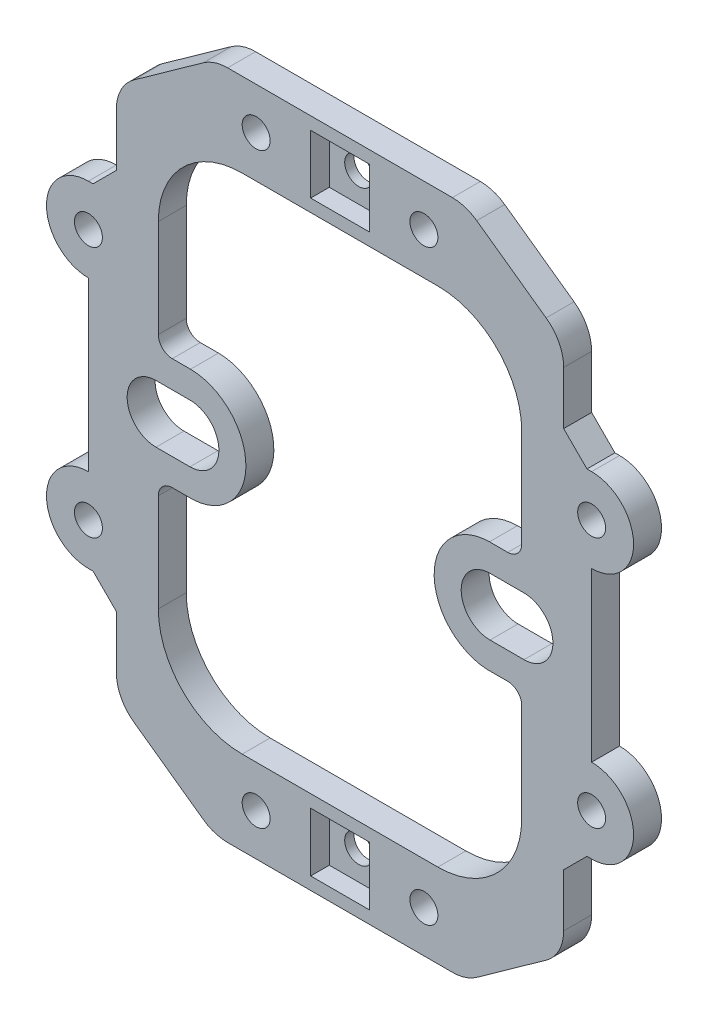
from build123d import *

# Parameters (mm, degrees)
MODEL_R                 = 1.5
SALIENTE_EXTRUIR1_DEPTH = 3
CROQUIS1_W              = 6.3
CROQUIS1_H              = 6.3
CORTAR_EXTRUIR1_DEPTH   = 2


with BuildPart() as part:
    # Model → Saliente-Extruir1 (new body)
    with BuildSketch(Plane.XY):
        with BuildLine():
            Line((64.337531364, 275.445982488), (61.837531364, 277.945982488))
            Line((61.837531364, 277.945982488), (61.837531364, 283.629591549))
            ThreePointArc((61.837531364, 283.629591549), (61.338785756, 285.688708663), (59.953103236, 287.29139217))
            Line((59.953103236, 287.29139217), (52.511010495, 292.607172698))
            ThreePointArc((52.511010495, 292.607172698), (51.268737063, 293.230701866), (49.895438624, 293.445372078))
            Line((49.895438624, 293.445372078), (25.779624104, 293.445372078))
            ThreePointArc((25.779624104, 293.445372078), (24.406325665, 293.230701866), (23.164052233, 292.607172698))
            Line((23.164052233, 292.607172698), (15.721959492, 287.29139217))
            ThreePointArc((15.721959492, 287.29139217), (14.336276972, 285.688708663), (13.837531364, 283.629591549))
            Line((13.837531364, 283.629591549), (13.837531364, 277.945982488))
            Line((13.837531364, 277.945982488), (11.337531364, 275.445982488))
            Line((11.337531364, 275.445982488), (10.837531364, 275.445982488))
            ThreePointArc((10.837531364, 275.445982488), (6.337531364, 270.945982488), (10.837531364, 266.445982488))
            Line((10.837531364, 266.445982488), (10.837531364, 248.445982488))
            ThreePointArc((10.837531364, 248.445982488), (6.337531364, 243.945982488), (10.837531364, 239.445982488))
            Line((10.837531364, 239.445982488), (11.337531364, 239.445982488))
            Line((11.337531364, 239.445982488), (13.837531364, 236.945982488))
            Line((13.837531364, 236.945982488), (13.837531364, 231.261763016))
            ThreePointArc((13.837531364, 231.261763016), (14.336276972, 229.202645903), (15.721959492, 227.599962396))
            Line((15.721959492, 227.599962396), (23.164052233, 222.284181867))
            ThreePointArc((23.164052233, 222.284181867), (24.406325665, 221.660652699), (25.779624104, 221.445982488))
            Line((25.779624104, 221.445982488), (49.895438624, 221.445982488))
            ThreePointArc((49.895438624, 221.445982488), (51.268737063, 221.660652699), (52.511010495, 222.284181867))
            Line((52.511010495, 222.284181867), (59.953103236, 227.599962396))
            ThreePointArc((59.953103236, 227.599962396), (61.338785756, 229.202645903), (61.837531364, 231.261763016))
            Line((61.837531364, 231.261763016), (61.837531364, 236.945982488))
            Line((61.837531364, 236.945982488), (64.337531364, 239.445982488))
            Line((64.337531364, 239.445982488), (64.837531364, 239.445982488))
            ThreePointArc((64.837531364, 239.445982488), (69.337531364, 243.945982488), (64.837531364, 248.445982488))
            Line((64.837531364, 248.445982488), (64.837531364, 266.445982488))
            ThreePointArc((64.837531364, 266.445982488), (69.337531364, 270.945982488), (64.837531364, 275.445982488))
            Line((64.837531364, 275.445982488), (64.337531364, 275.445982488))
        make_face()
        with Locations((28.837531364, 225.945982488)):
            Circle(MODEL_R, mode=Mode.SUBTRACT)
        with Locations((10.837531364, 243.945982488)):
            Circle(MODEL_R, mode=Mode.SUBTRACT)
        with BuildLine():
            ThreePointArc((18.092271793, 254.345372089), (14.992271793, 257.445372089), (18.092271793, 260.545372089))
            Line((18.092271793, 260.545372089), (21.737271793, 260.545677294))
            ThreePointArc((21.737271793, 260.545677294), (24.837271793, 257.445677294), (21.737271793, 254.345677294))
            Line((21.737271793, 254.345677294), (18.092271793, 254.345372089))
        make_face(mode=Mode.SUBTRACT)
        with Locations((37.837531364, 225.945982488)):
            Circle(MODEL_R, mode=Mode.SUBTRACT)
        with Locations((46.837531364, 225.945982488)):
            Circle(MODEL_R, mode=Mode.SUBTRACT)
        with Locations((64.837531364, 243.945982488)):
            Circle(MODEL_R, mode=Mode.SUBTRACT)
        with BuildLine():
            ThreePointArc((53.937271793, 254.345677294), (50.837271793, 257.445677294), (53.937271793, 260.545677294))
            Line((53.937271793, 260.545677294), (57.582271793, 260.545372089))
            ThreePointArc((57.582271793, 260.545372089), (60.682141998, 257.445242304), (57.582012214, 254.3453721))
            Line((57.582012214, 254.3453721), (53.937271793, 254.345677294))
        make_face(mode=Mode.SUBTRACT)
        with Locations((10.837531364, 270.945982488)):
            Circle(MODEL_R, mode=Mode.SUBTRACT)
        with Locations((28.837531364, 288.945982488)):
            Circle(MODEL_R, mode=Mode.SUBTRACT)
        with BuildLine():
            Line((18.337531364, 264.945372078), (18.337531364, 275.445372078))
            ThreePointArc((18.337531364, 275.445372078), (20.973570333, 281.809333109), (27.337531364, 284.445372078))
            Line((27.337531364, 284.445372078), (48.337531364, 284.445372078))
            ThreePointArc((48.337531364, 284.445372078), (54.701492395, 281.809333109), (57.337531364, 275.445372078))
            Line((57.337531364, 275.445372078), (57.337531364, 264.945372078))
            ThreePointArc((57.337531364, 264.945372078), (56.898191536, 263.884711906), (55.837531364, 263.445372078))
            Line((55.837531364, 263.445372078), (53.998048837, 263.445372078))
            Line((53.998048837, 263.445372078), (53.877013891, 263.445372078))
            ThreePointArc((53.877013891, 263.445372078), (47.939939639, 257.615658143), (53.537303053, 251.459040723))
            Line((53.537303053, 251.459040723), (55.837531364, 251.459040723))
            ThreePointArc((55.837531364, 251.459040723), (56.898191536, 251.019700895), (57.337531364, 249.959040723))
            Line((57.337531364, 249.959040723), (57.337531364, 239.445982488))
            ThreePointArc((57.337531364, 239.445982488), (54.701492395, 233.082021457), (48.337531364, 230.445982488))
            Line((48.337531364, 230.445982488), (27.337531364, 230.445982488))
            ThreePointArc((27.337531364, 230.445982488), (20.973570333, 233.082021457), (18.337531364, 239.445982488))
            Line((18.337531364, 239.445982488), (18.337531364, 249.959040723))
            ThreePointArc((18.337531364, 249.959040723), (18.776871192, 251.019700895), (19.837531364, 251.459040723))
            Line((19.837531364, 251.459040723), (22.137759676, 251.459040723))
            ThreePointArc((22.137759676, 251.459040723), (27.735123089, 257.615658143), (21.798048837, 263.445372078))
            Line((21.798048837, 263.445372078), (21.677013891, 263.445372078))
            Line((21.677013891, 263.445372078), (19.837531364, 263.445372078))
            ThreePointArc((19.837531364, 263.445372078), (18.776871192, 263.884711906), (18.337531364, 264.945372078))
        make_face(mode=Mode.SUBTRACT)
        with Locations((64.837531364, 270.945982488)):
            Circle(MODEL_R, mode=Mode.SUBTRACT)
        with Locations((37.837531364, 288.945982488)):
            Circle(MODEL_R, mode=Mode.SUBTRACT)
        with Locations((46.837531364, 288.945982488)):
            Circle(MODEL_R, mode=Mode.SUBTRACT)
    extrude(amount=SALIENTE_EXTRUIR1_DEPTH)

    # Croquis1 → Cortar-Extruir1 (cut)
    with BuildSketch(Plane.XY.offset(3)):
        with Locations((37.837531364, 288.945982488)):
            Rectangle(CROQUIS1_W, CROQUIS1_H)
        with Locations((37.837531364, 225.945982488)):
            Rectangle(CROQUIS1_W, CROQUIS1_H)
    extrude(amount=-CORTAR_EXTRUIR1_DEPTH, mode=Mode.SUBTRACT)


solid = part.part
